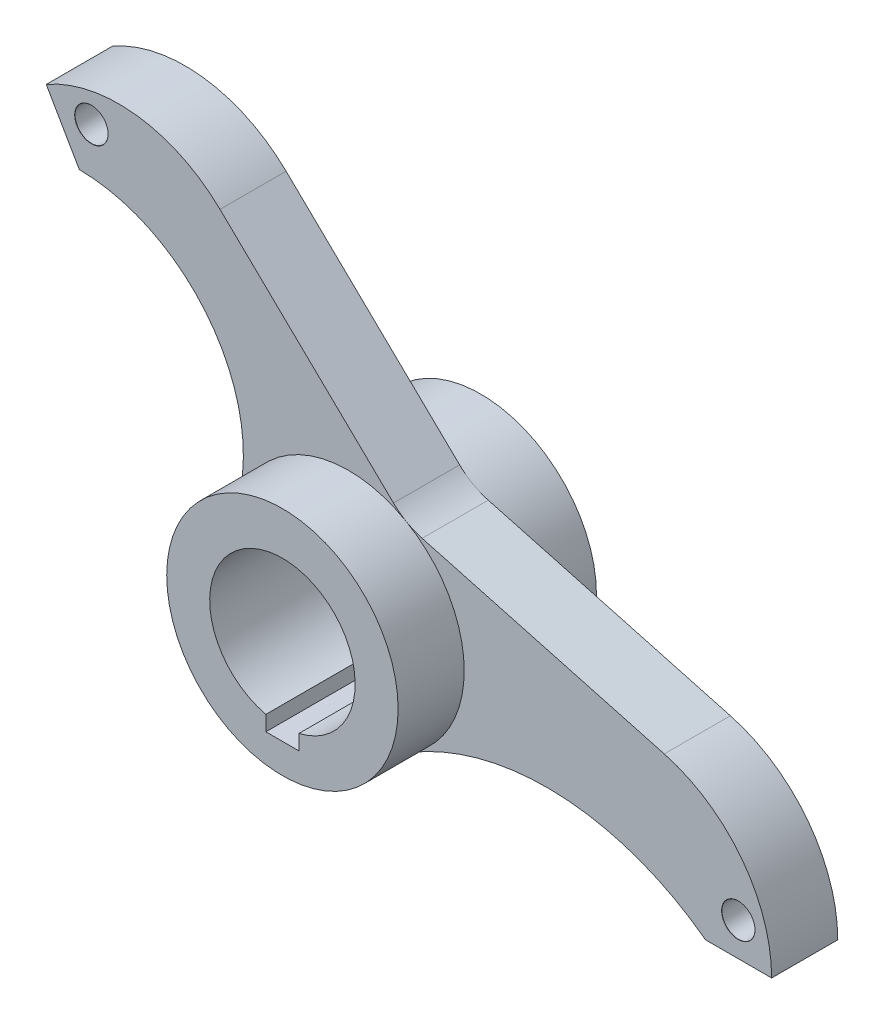
from build123d import *

# Parameters (mm, degrees)
SCHIZZO2_R                   = 17.5
ESTRUSIONE_ESTRUSIONE2_DEPTH = 15
ESTRUSIONE_ESTRUSIONE3_DEPTH = 5
FORO_5_0_5_1_D               = 5
FORO_5_0_5_1_CSINK_D         = 5.05
FORO_5_0_5_1_CSINK_ANGLE     = 90


with BuildPart() as part:
    # Schizzo2 → Estrusione-Estrusione2 (new, symmetric)
    with BuildSketch(Plane.XY):
        Circle(SCHIZZO2_R)
        with BuildLine():
            ThreePointArc((2.5, -10.712142643), (0, 11), (-2.5, -10.712142643))
            Line((-2.5, -10.712142643), (-2.5, -13))
            Line((-2.5, -13), (2.5, -13))
            Line((2.5, -13), (2.5, -10.712142643))
        make_face(mode=Mode.SUBTRACT)
    extrude(amount=ESTRUSIONE_ESTRUSIONE2_DEPTH, both=True)

    # Schizzo2<8> → Estrusione-Estrusione3 (add, symmetric)
    with BuildSketch(Plane.XY):
        with BuildLine():
            Line((-45.722431864, 45.193575035), (-40.722431864, 36.533320997))
            ThreePointArc((-40.722431864, 36.533320997), (-20.917414575, 26.550556749), (-16.843225773, 4.749288954))
            ThreePointArc((-16.843225773, 4.749288954), (-6.591440531, 16.211197109), (8.750000884, 15.155444056))
            ThreePointArc((8.750000884, 15.155444056), (7.731750254, 15.829418494), (6.803236294, 16.62247443))
            Line((6.803236294, 16.62247443), (-19.439551712, 41.966109335))
            ThreePointArc((-19.439551712, 41.966109335), (-32.041033104, 47.97699794), (-45.722431864, 45.193575035))
        make_face()
        with BuildLine():
            ThreePointArc((17.5, 0), (15.268302341, -8.551546271), (9.142406443, -14.922010737))
            ThreePointArc((9.142406443, -14.922010737), (31.890315924, -9.07231341), (54, -17))
            Line((54, -17), (64, -17))
            ThreePointArc((64, -17), (59.47377273, -3.633352456), (47.757521221, 4.233251032))
            Line((47.757521221, 4.233251032), (11.132944899, 14.164220862))
            ThreePointArc((11.132944899, 14.164220862), (9.909360784, 14.582633544), (8.750000884, 15.155444056))
            ThreePointArc((8.750000884, 15.155444056), (15.155444821, 8.749999558), (17.5, 0))
        make_face()
    extrude(amount=ESTRUSIONE_ESTRUSIONE3_DEPTH, both=True)

    # Foro Ø5.0 (5)-1 (through all)
    with Locations(Plane(origin=(-38.892335599, 43.363541782, 5), x_dir=(1, 0, 0), z_dir=(0, 0, 1))):
        with Locations((0, 0), (97.848441208, -55.318294404)):
            CounterSinkHole(FORO_5_0_5_1_D / 2, FORO_5_0_5_1_CSINK_D / 2, counter_sink_angle=FORO_5_0_5_1_CSINK_ANGLE)


solid = part.part
